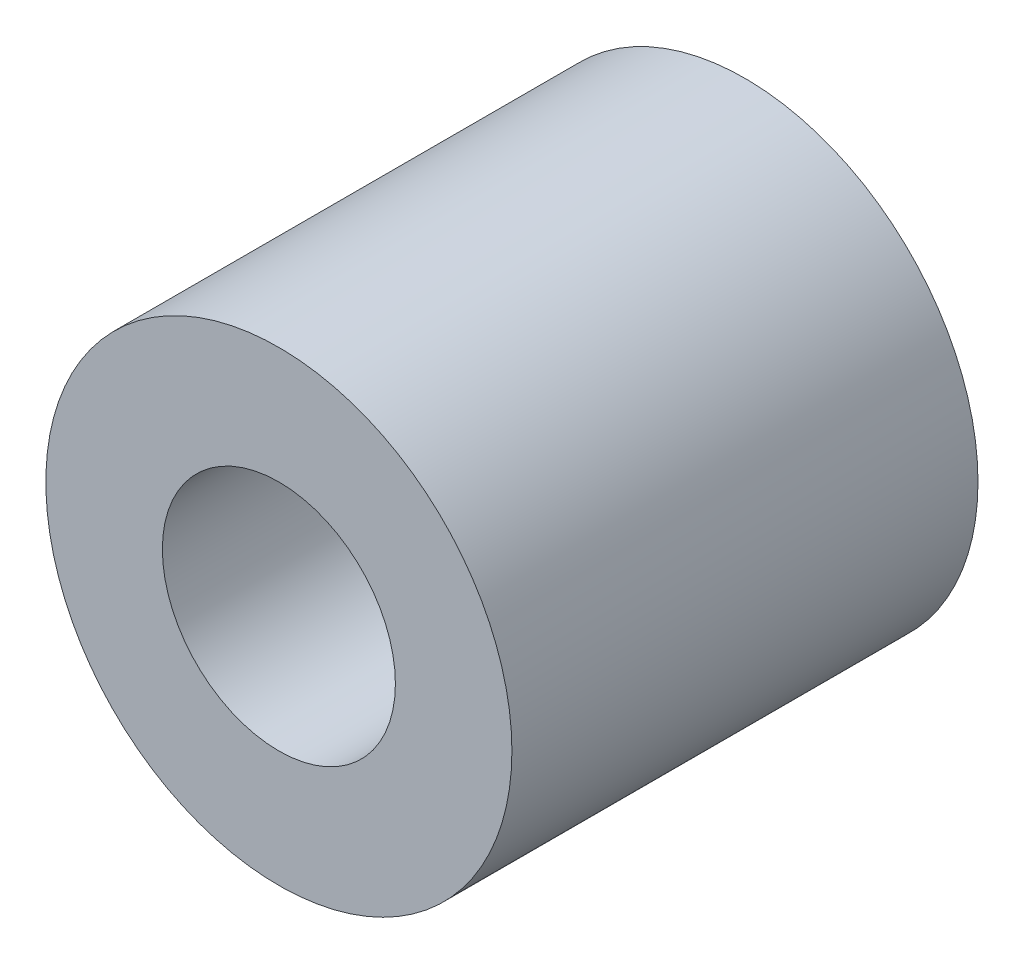
from build123d import *

# Parameters (mm, degrees)
SKETCH_1_R      = 4
SKETCH_1_R_2    = 2
EXTRUDE_1_DEPTH = 8


with BuildPart() as part:
    # Эскиз1 → Бобышка-Вытянуть1 (new body)
    with BuildSketch(Plane.XY):
        Circle(SKETCH_1_R)
        Circle(SKETCH_1_R_2, mode=Mode.SUBTRACT)
    extrude(amount=EXTRUDE_1_DEPTH)


solid = part.part
